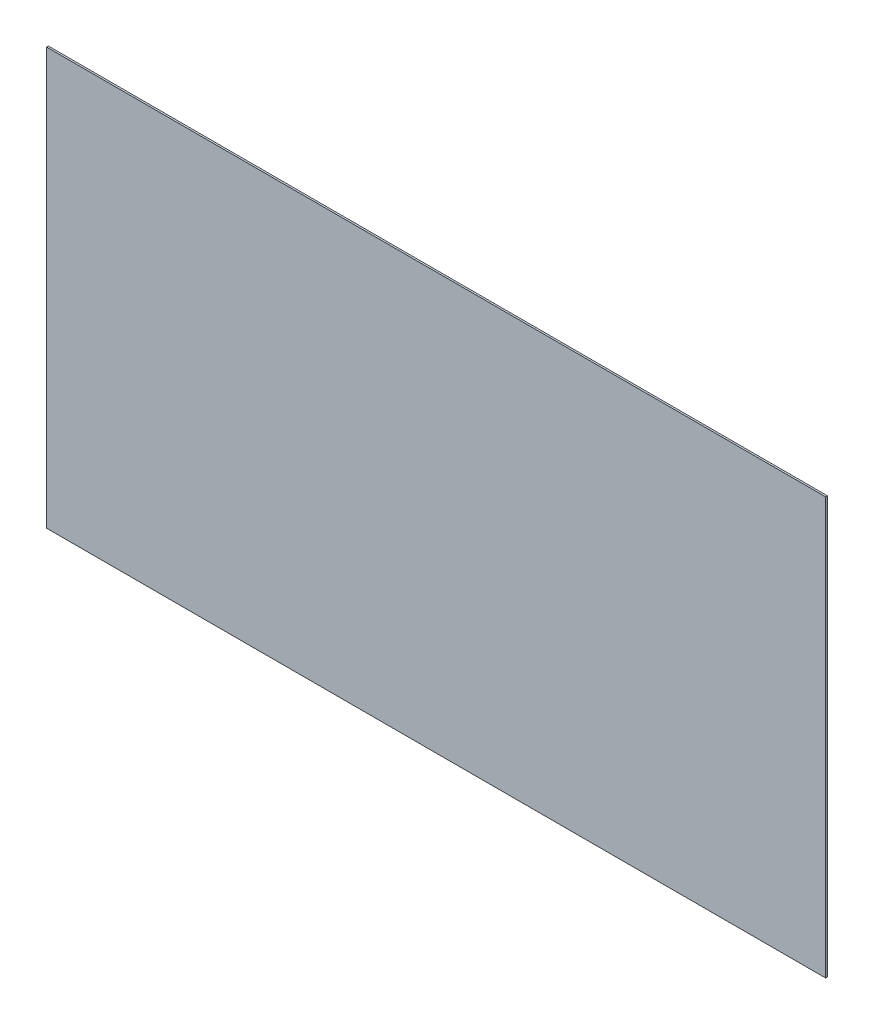
from build123d import *

# Parameters (mm, degrees)
SKETCH1_W           = 43
SKETCH1_H           = 23
BOSS_EXTRUDE1_DEPTH = 0.1


with BuildPart() as part:
    # Sketch1 → Boss-Extrude1 (new body)
    with BuildSketch(Plane.XY):
        Rectangle(SKETCH1_W, SKETCH1_H)
    extrude(amount=BOSS_EXTRUDE1_DEPTH)


solid = part.part
